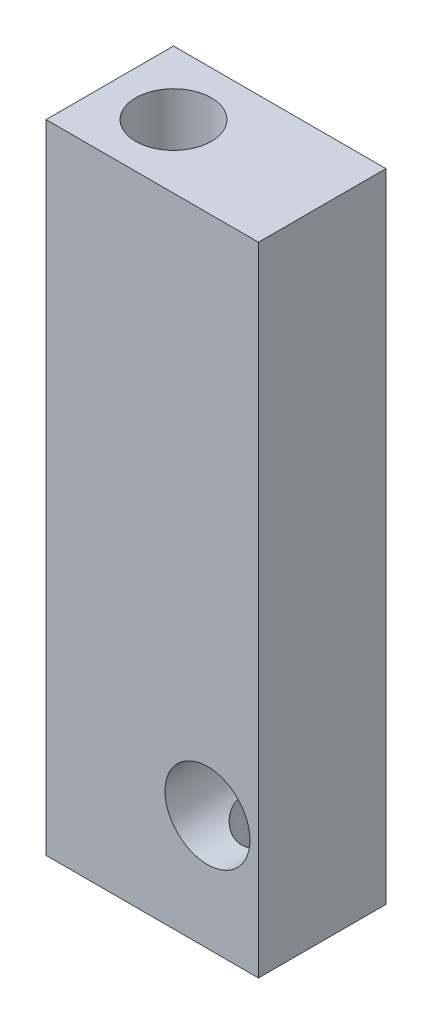
from build123d import *

# Parameters (mm, degrees)
SKETCH1_W                  = 6.35
SKETCH1_H                  = 3.81
BOSS_EXTRUDE1_DEPTH        = 19.05
F_4_40_TAPPED_HOLE1_D      = 2.2606
F_4_40_TAPPED_HOLE1_DEPTH  = 7.62
F_4_40_TAPPED_HOLE1_TIP    = 0.679152758
SKETCH8_R                  = 1.27
CUT_EXTRUDE3_DEPTH         = 20.685
F_2_56_TAPPED_HOLE2_REACH  = 21.406
F_2_56_TAPPED_HOLE2_BORE_R = 0.889


with BuildPart() as part:
    # Sketch1 → Boss-Extrude1 (new body)
    with BuildSketch(Plane(origin=(0, 0, 0), x_dir=(1, 0, 0), z_dir=(0, 1, 0))):
        Rectangle(SKETCH1_W, SKETCH1_H)
    extrude(amount=-BOSS_EXTRUDE1_DEPTH)

    # #4-40 Tapped Hole1
    with Locations(Plane(origin=(0, 0, 0), x_dir=(1, 0, 0), z_dir=(0, 1, 0))):
        with Locations((-1.27, 0)):
            Hole(F_4_40_TAPPED_HOLE1_D / 2, depth=F_4_40_TAPPED_HOLE1_DEPTH)
            with Locations((0, 0, -(F_4_40_TAPPED_HOLE1_DEPTH + F_4_40_TAPPED_HOLE1_TIP / 2))):  # 118° drill point
                Cone(0, F_4_40_TAPPED_HOLE1_D / 2, F_4_40_TAPPED_HOLE1_TIP, mode=Mode.SUBTRACT)

    # Sketch8 → Cut-Extrude3 (cut, through all)
    with BuildSketch(Plane.XY.offset(1.905)):
        with Locations((1.651, -15.60576)):
            Circle(SKETCH8_R)
    extrude(amount=-CUT_EXTRUDE3_DEPTH, mode=Mode.SUBTRACT)

    # #2-56 Tapped Hole2 bore → #2-56 Tapped Hole2 (cut, up to next)
    with BuildSketch(Plane(origin=(0, -19.05, 0), x_dir=(-1, 0, 0), z_dir=(0, -1, 0)), mode=Mode.PRIVATE) as f_2_56_tapped_hole2_sk1:
        with Locations((-1.651, 0)):
            Circle(F_2_56_TAPPED_HOLE2_BORE_R)
    f_2_56_tapped_hole2_tool1 = extrude(f_2_56_tapped_hole2_sk1.sketch, amount=-F_2_56_TAPPED_HOLE2_REACH, mode=Mode.PRIVATE) & part.part
    add(f_2_56_tapped_hole2_tool1.solids().sort_by_distance((1.651, -19.05, 0))[0], mode=Mode.SUBTRACT)


solid = part.part
